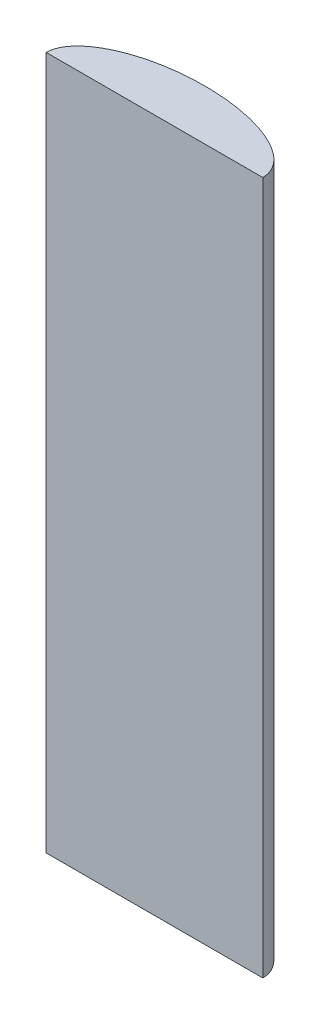
from build123d import *

# Parameters (mm, degrees)
BOSS_EXTRUDE1_DEPTH = 812.8


with BuildPart() as part:
    # Sketch1 → Boss-Extrude1 (new body)
    with BuildSketch(Plane(origin=(0, 0, 0), x_dir=(1, 0, 0), z_dir=(0, 1, 0))):
        with BuildLine():
            Line((0, 0), (254, 0))
            add(Edge.make_bspline(
                [(254, 0), (254, 58.99402507), (127, 58.99402507), (0, 58.99402507), (0, 0)],
                knots=[0, 0, 0, 1.570796327, 1.570796327, 3.141592654, 3.141592654, 3.141592654], degree=2, weights=[1, 0.707106781, 1, 0.707106781, 1]))
        make_face()
    extrude(amount=BOSS_EXTRUDE1_DEPTH)


solid = part.part
